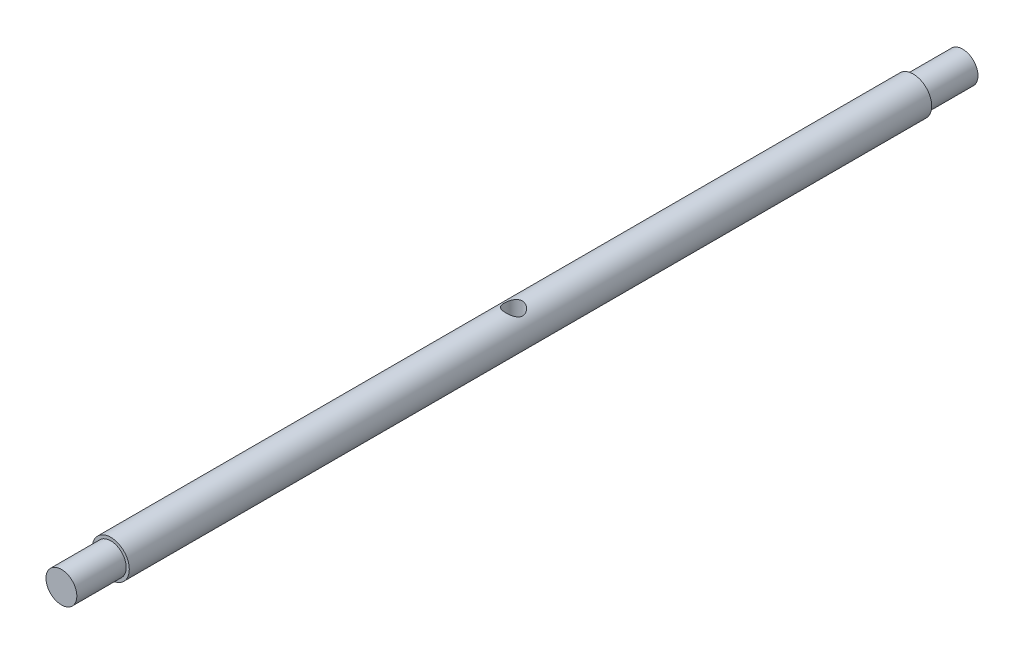
from build123d import *

# Parameters (mm, degrees)
SKETCH1_R                           = 3
BOSS_EXTRUDE1_DEPTH                 = 130
SKETCH2_R                           = 2.5
BOSS_EXTRUDE2_DEPTH                 = 8
BOSS_EXTRUDE3_START                 = 8
SKETCH3_R                           = 2.5
BOSS_EXTRUDE3_DEPTH                 = 8
CUT_EXTRUDE1_REACH                  = 140.065
CUT_EXTRUDE1_END_RADIUS             = 3
SKETCH4_R                           = 1.5
CUT_EXTRUDE1_DIRECTION_2_REACH      = 140.065
CUT_EXTRUDE1_DIRECTION_2_END_RADIUS = 3


with BuildPart() as part:
    # Sketch1 → Boss-Extrude1 (new body)
    with BuildSketch(Plane.XY):
        Circle(SKETCH1_R)
    extrude(amount=BOSS_EXTRUDE1_DEPTH)

    # Sketch2 → Boss-Extrude2 (add)
    with BuildSketch(Plane.XY.offset(130)):
        Circle(SKETCH2_R)
    extrude(amount=BOSS_EXTRUDE2_DEPTH)

    # Sketch3 → Boss-Extrude3 (add)
    with BuildSketch(Plane(origin=(0, 0, 0), x_dir=(-1, 0, 0), z_dir=(0, 0, -1)).offset(BOSS_EXTRUDE3_START)):
        with Locations(Location((0, 0, 0), (0, 0, 180))):
            Circle(SKETCH3_R)
    extrude(amount=-BOSS_EXTRUDE3_DEPTH)

    # Cut-Extrude1: up to this cylinder (the profile starts inside it)
    cut_extrude1_end = Plane(origin=(0, 0, 65), z_dir=(0, 0, -1)) * Cylinder(CUT_EXTRUDE1_END_RADIUS, 287.13, mode=Mode.PRIVATE)
    # Sketch4 → Cut-Extrude1 (cut, up to the surface)
    with BuildSketch(Plane(origin=(0, 0, 0), x_dir=(1, 0, 0), z_dir=(0, 1, 0)), mode=Mode.PRIVATE) as cut_extrude1_sk1:
        with Locations(Location((0.25, -65, 0), (0, 0, 270))):
            Circle(SKETCH4_R)
    cut_extrude1_tool1 = extrude(cut_extrude1_sk1.sketch, amount=-CUT_EXTRUDE1_REACH, mode=Mode.PRIVATE) & cut_extrude1_end
    add(cut_extrude1_tool1.solids().sort_by_distance((0.25, 0, 65))[0], mode=Mode.SUBTRACT)

    # Cut-Extrude1 direction 2: up to this cylinder (the profile starts inside it)
    cut_extrude1_direction_2_end = Plane(origin=(0, 0, 65), z_dir=(0, 0, -1)) * Cylinder(CUT_EXTRUDE1_DIRECTION_2_END_RADIUS, 287.13, mode=Mode.PRIVATE)
    # Sketch4 → Cut-Extrude1 direction 2 (cut, up to the surface)
    with BuildSketch(Plane(origin=(0, 0, 0), x_dir=(1, 0, 0), z_dir=(0, 1, 0)), mode=Mode.PRIVATE) as cut_extrude1_direction_2_sk1:
        with Locations(Location((0.25, -65, 0), (0, 0, 270))):
            Circle(SKETCH4_R)
    cut_extrude1_direction_2_tool1 = extrude(cut_extrude1_direction_2_sk1.sketch, amount=CUT_EXTRUDE1_DIRECTION_2_REACH, mode=Mode.PRIVATE) & cut_extrude1_direction_2_end
    add(cut_extrude1_direction_2_tool1.solids().sort_by_distance((0.25, 0, 65))[0], mode=Mode.SUBTRACT)


solid = part.part
